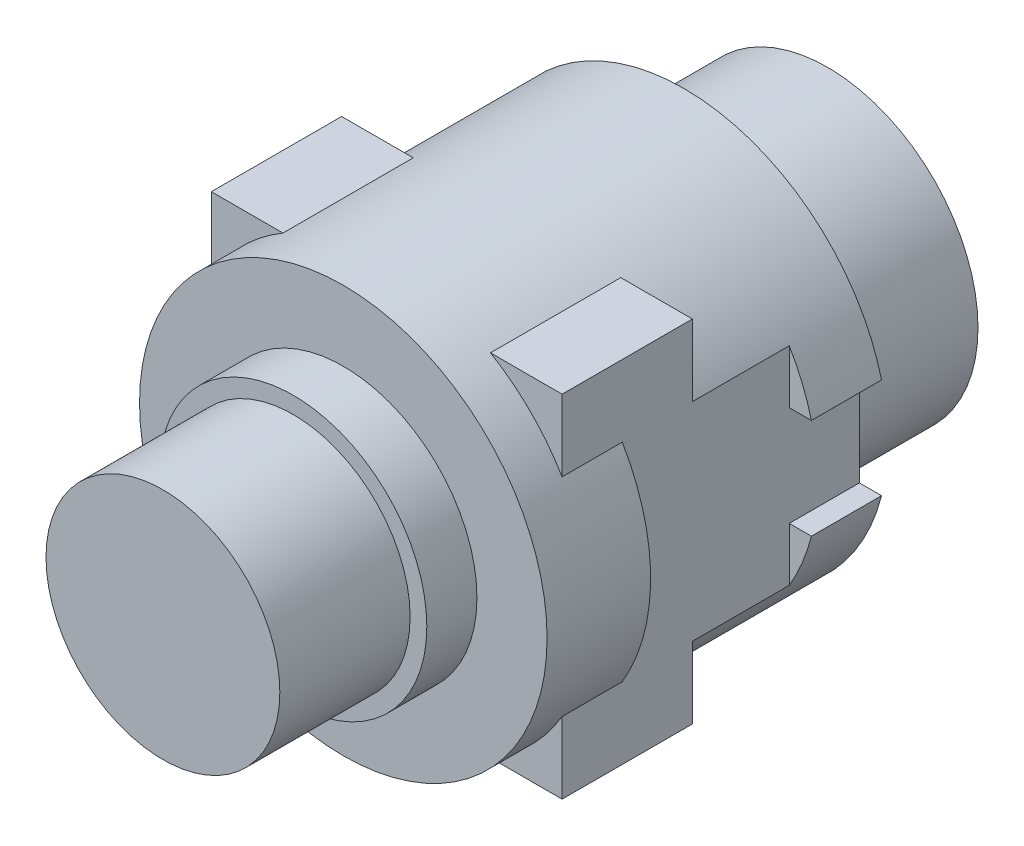
from build123d import *

# Parameters (mm, degrees)
SKETCH_1_R          = 6.1
EXTRUDE_1_DEPTH     = 10.2
EXTRUDE_START       = 8.9
SKETCH_1_5_W        = 10.5
SKETCH_1_5_H        = 10.5
EXTRUDE_2_DEPTH     = 3.9
CUT_EXTRUDE_START   = 2.1
CUT_EXTRUDE_1_DEPTH = 5
SKETCH_3_W          = 5.6626982
SKETCH_3_H          = 3
CUT_EXTRUDE_2_DEPTH = 12.83342723
SKETCH_4_R          = 4.5
EXTRUDE_3_DEPTH     = 4.3
SKETCH_5_R          = 3
CUT_EXTRUDE_3_DEPTH = 2.1
SKETCH_6_R          = 4
SKETCH_6_R_2        = 3.5
EXTRUDE_4_DEPTH     = 1.5
SKETCH_6_2_R        = 3.5
EXTRUDE_5_DEPTH     = 5.4


with BuildPart() as part:
    # 草图1 → 凸台-拉伸1 (new body)
    with BuildSketch(Plane.XY):
        Circle(SKETCH_1_R)
    extrude(amount=EXTRUDE_1_DEPTH)

    # 草图1<5> → 凸台-拉伸2 (add)
    with BuildSketch(Plane.XY.offset(EXTRUDE_START)):
        Rectangle(SKETCH_1_5_W, SKETCH_1_5_H)
    extrude(amount=-EXTRUDE_2_DEPTH)

    # 草图1<6> → 切除-拉伸1 (cut)
    with BuildSketch(Plane.XY.offset(CUT_EXTRUDE_START)):
        with BuildLine():
            ThreePointArc((-5.25, 3.106042498), (-6.1, 0), (-5.25, -3.106042498))
            Line((-5.25, -3.106042498), (-5.25, 3.106042498))
        make_face()
        with BuildLine():
            Line((5.25, 3.106042498), (5.25, -3.106042498))
            ThreePointArc((5.25, -3.106042498), (6.1, 0), (5.25, 3.106042498))
        make_face()
    extrude(amount=CUT_EXTRUDE_1_DEPTH, mode=Mode.SUBTRACT)

    # 草图3 → 切除-拉伸2 (cut, through all)
    with BuildSketch(Plane.XY.offset(2.1)):
        with BuildLine():
            Line((5.9126982, 1.5), (5.25, 1.5))
            Line((5.25, 1.5), (5.25, -1.5))
            Line((5.25, -1.5), (5.9126982, -1.5))
            ThreePointArc((5.9126982, -1.5), (6.1, 0), (5.9126982, 1.5))
        make_face()
        with Locations((-8.0813491, 0)):
            Rectangle(SKETCH_3_W, SKETCH_3_H)
    extrude(amount=-CUT_EXTRUDE_2_DEPTH, mode=Mode.SUBTRACT)

    # 草图4 → 凸台-拉伸3 (add)
    with BuildSketch(Plane(origin=(0, 0, 0), x_dir=(-1, 0, 0), z_dir=(0, 0, -1))):
        Circle(SKETCH_4_R)
    extrude(amount=EXTRUDE_3_DEPTH)

    # 草图5 → 切除-拉伸3 (cut)
    with BuildSketch(Plane(origin=(0, 0, -4.3), x_dir=(-1, 0, 0), z_dir=(0, 0, -1))):
        Circle(SKETCH_5_R)
    extrude(amount=-CUT_EXTRUDE_3_DEPTH, mode=Mode.SUBTRACT)

    # 草图6 → 凸台-拉伸4 (add)
    with BuildSketch(Plane.XY.offset(10.2)):
        Circle(SKETCH_6_R)
        Circle(SKETCH_6_R_2, mode=Mode.SUBTRACT)
    extrude(amount=EXTRUDE_4_DEPTH)

    # 草图6<2> → 凸台-拉伸5 (add)
    with BuildSketch(Plane.XY.offset(10.2)):
        Circle(SKETCH_6_2_R)
    extrude(amount=EXTRUDE_5_DEPTH)


solid = part.part
